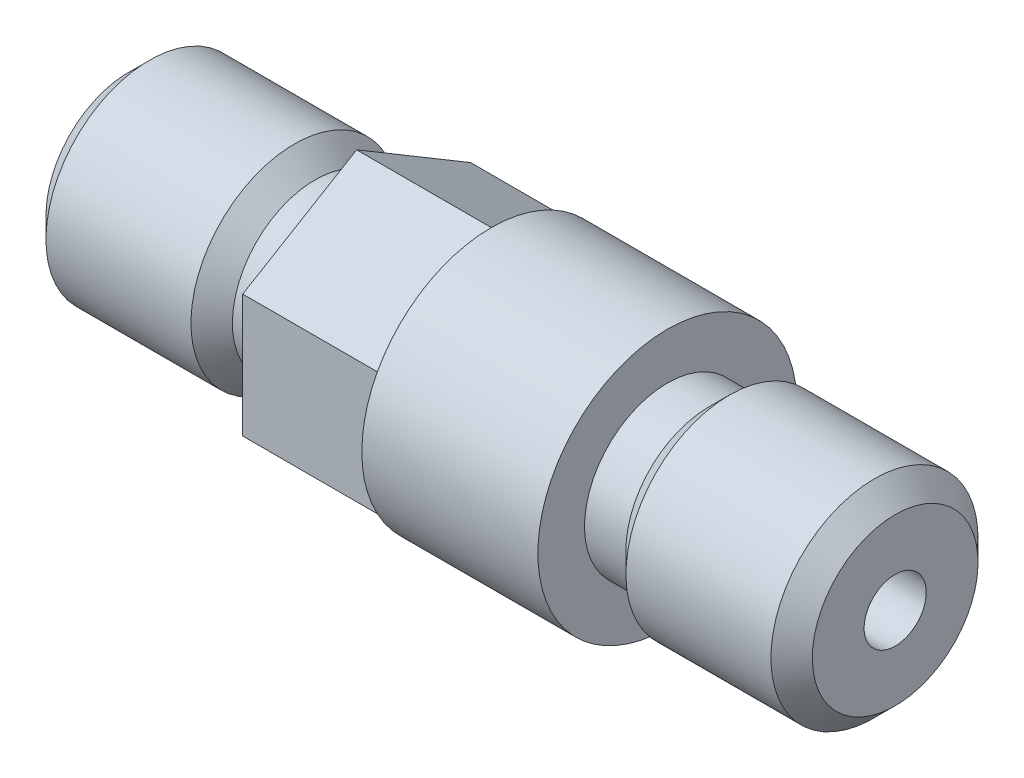
from build123d import *

# Parameters (mm, degrees)
RESSALTO_EXTRUS_O1_DEPTH = 6.5
ESBO_O4_R                = 1.5
CORTE_EXTRUS_O1_DEPTH    = 31.317074397


with BuildPart() as part:
    # Esboço1 → Revolução1 (revolve)
    with BuildSketch(Plane.XY):
        Polygon((0, 0), (-19.5, 0), (-19.5, 6.25), (-11, 6.25), (-11, 4), (-9, 4), (-8, 5), (-1, 5), (0, 4), align=None)
    revolve(axis=Axis((0, 0, 0), (-1, 0, 0)))

    # Esboço2 → Ressalto-extrusão1 (add)
    with BuildSketch(Plane.ZY.offset(19.5)):
        Polygon((-5.5, 2.968585522), (-5.5, -2.968585522), (0, -6.25), (5.5, -2.968585522), (5.5, 2.968585522), (0, 6.25), align=None)
    extrude(amount=RESSALTO_EXTRUS_O1_DEPTH)

    # Esboço3 → Revolução2 (revolve)
    with BuildSketch(Plane.XY, mode=Mode.PRIVATE) as revolu_o2_sk:
        Polygon((-29, 0), (-26, 0), (-26, 4), (-28, 4), (-29, 5), (-36, 5), (-37, 4), (-37, 2.5), (-29.707106781, 2.5), (-29, 1.792893219), align=None)
    revolve(revolu_o2_sk.sketch.rotate(Axis((-29, 0, 0), (1, 0, 0)), 180), axis=Axis((-29, 0, 0), (1, 0, 0)))

    # Esboço4 → Corte-extrusão1 (cut, through all)
    with BuildSketch(Plane.ZY.offset(29)):
        with Locations(Location((0, 0, 0), (0, 0, 270))):
            Circle(ESBO_O4_R)
    extrude(amount=-CORTE_EXTRUS_O1_DEPTH, mode=Mode.SUBTRACT)


solid = part.part
